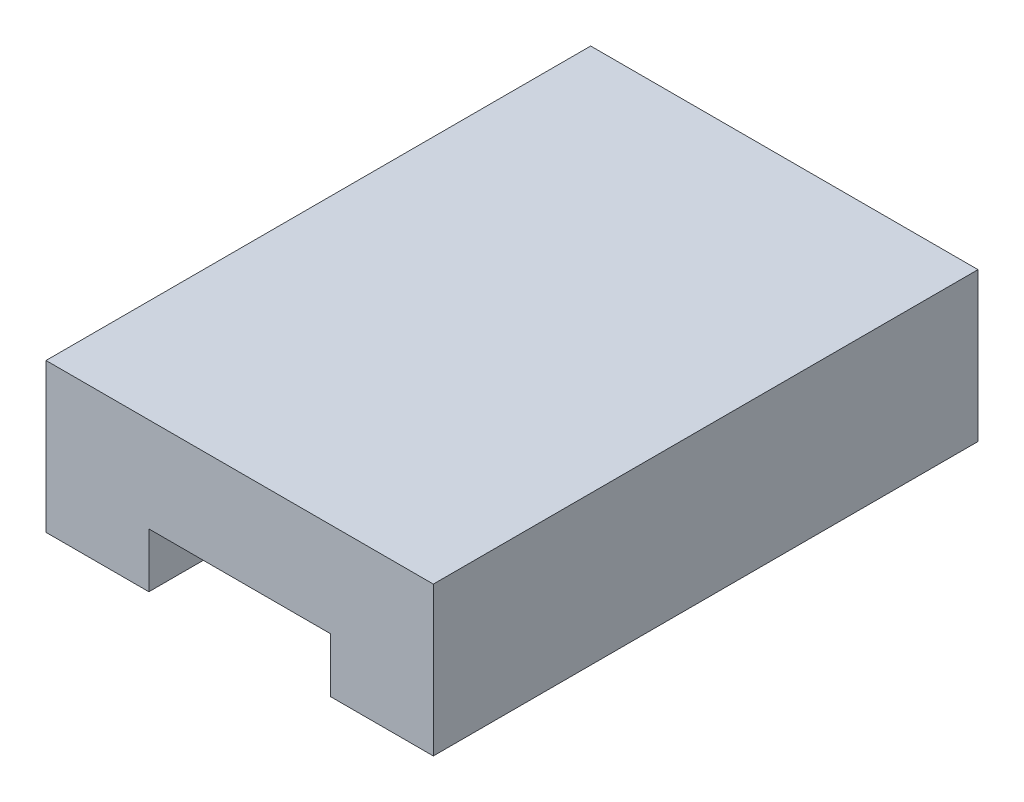
from build123d import *

# Parameters (mm, degrees)
EXTRUDE_2_DEPTH = 45


with BuildPart() as part:
    # 草图1 → 凸台-拉伸2 (new body)
    with BuildSketch(Plane.XY):
        Polygon((0, 12.3), (0, 0), (8.5, 0), (8.5, 4.5), (23.5, 4.5), (23.5, 0), (32, 0), (32, 12.3), align=None)
    extrude(amount=EXTRUDE_2_DEPTH)


solid = part.part
